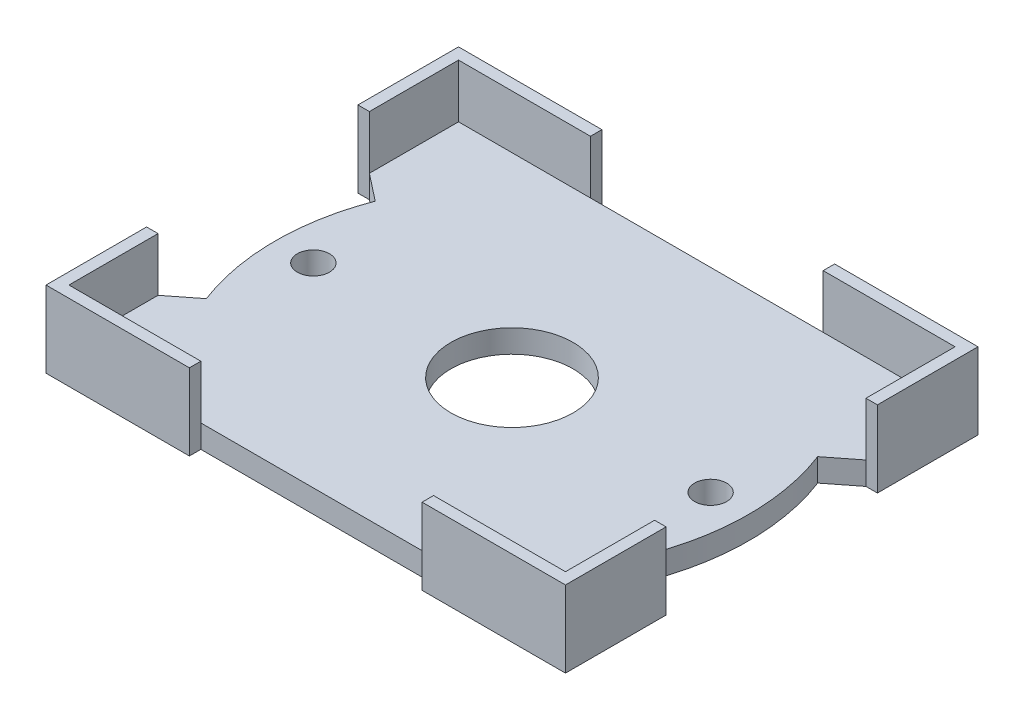
from build123d import *

# Parameters (mm, degrees)
BOSS_EXTRUDE1_DEPTH   = 10
BOSS_EXTRUDE1_2_DEPTH = 10
BOSS_EXTRUDE1_3_DEPTH = 10
BOSS_EXTRUDE1_4_DEPTH = 10
SKETCH1_9_R           = 8
SKETCH1_9_R_2         = 2.1
BOSS_EXTRUDE2_DEPTH   = 3


with BuildPart() as part:
    # Sketch1 → Boss-Extrude1 (new body)
    with BuildSketch(Plane(origin=(0, 0, 0), x_dir=(1, 0, 0), z_dir=(0, 1, 0))):
        Polygon((32.5, -13.831280473), (32.5, -25.5), (15.231546212, -25.5), (15.231546212, -27), (34, -27), (34, -13.831280473), align=None)
    extrude(amount=BOSS_EXTRUDE1_DEPTH)



with BuildPart() as body_2:
    # Sketch1 → Boss-Extrude1 2 (new body)
    with BuildSketch(Plane(origin=(0, 0, 0), x_dir=(1, 0, 0), z_dir=(0, 1, 0))):
        Polygon((32.5, 25.5), (32.5, 13.831280473), (34, 13.831280473), (34, 27), (15.231546212, 27), (15.231546212, 25.5), align=None)
    extrude(amount=BOSS_EXTRUDE1_2_DEPTH)


with BuildPart() as body_3:
    # Sketch1 → Boss-Extrude1 3 (new body)
    with BuildSketch(Plane(origin=(0, 0, 0), x_dir=(1, 0, 0), z_dir=(0, 1, 0))):
        Polygon((-15.231546212, -27), (-15.231546212, -25.5), (-32.5, -25.5), (-32.5, -13.831280473), (-34, -13.831280473), (-34, -27), align=None)
    extrude(amount=BOSS_EXTRUDE1_3_DEPTH)


with BuildPart() as body_4:
    # Sketch1 → Boss-Extrude1 4 (new body)
    with BuildSketch(Plane(origin=(0, 0, 0), x_dir=(1, 0, 0), z_dir=(0, 1, 0))):
        Polygon((-32.5, 25.5), (-15.231546212, 25.5), (-15.231546212, 27), (-34, 27), (-34, 13.831280473), (-32.5, 13.831280473), align=None)
    extrude(amount=BOSS_EXTRUDE1_4_DEPTH)


with BuildPart() as part_1:
    add(part.part)

    add(body_2.part)  # Boss-Extrude2 merges body 2

    add(body_3.part)  # Boss-Extrude2 merges body 3

    add(body_4.part)  # Boss-Extrude2 merges body 4
    # Sketch1<9> → Boss-Extrude2 (add)
    with BuildSketch(Plane(origin=(0, 0, 0), x_dir=(1, 0, 0), z_dir=(0, 1, 0))):
        with BuildLine():
            Line((32.5, -25.5), (32.5, -13.831280473))
            Line((32.5, -13.831280473), (28.961769494, -11.055130384))
            ThreePointArc((28.961769494, -11.055130384), (31, 0), (28.961769494, 11.055130384))
            Line((28.961769494, 11.055130384), (32.5, 13.831280473))
            Line((32.5, 13.831280473), (32.5, 25.5))
            Line((32.5, 25.5), (-32.5, 25.5))
            Line((-32.5, 25.5), (-32.5, 13.831280473))
            Line((-32.5, 13.831280473), (-28.961769494, 11.055130384))
            ThreePointArc((-28.961769494, 11.055130384), (-31, 0), (-28.961769494, -11.055130384))
            Line((-28.961769494, -11.055130384), (-32.5, -13.831280473))
            Line((-32.5, -13.831280473), (-32.5, -25.5))
            Line((-32.5, -25.5), (32.5, -25.5))
        make_face()
        Circle(SKETCH1_9_R, mode=Mode.SUBTRACT)
        with Locations((26, 0)):
            Circle(SKETCH1_9_R_2, mode=Mode.SUBTRACT)
        with Locations((-26, 0)):
            Circle(SKETCH1_9_R_2, mode=Mode.SUBTRACT)
    extrude(amount=BOSS_EXTRUDE2_DEPTH)


solid = part_1.part
